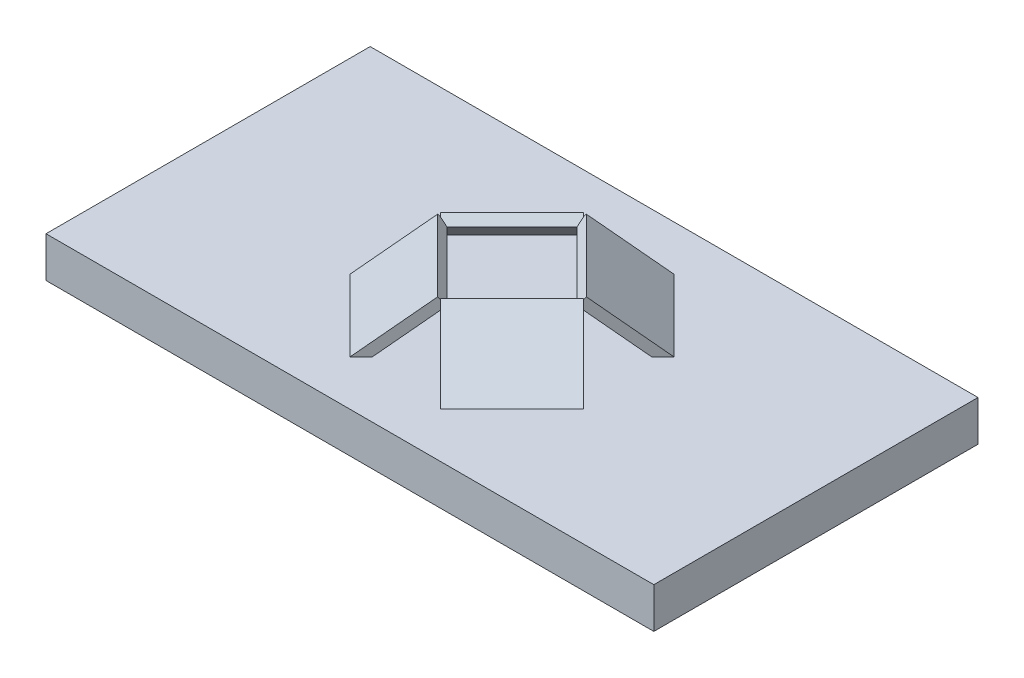
from build123d import *

# Parameters (mm, degrees)
SKETCH1_W           = 30
SKETCH1_H           = 16
BOSS_EXTRUDE1_DEPTH = 2
SKETCH4_W           = 5
SKETCH4_H           = 4
BOSS_EXTRUDE2_DEPTH = 0.5
CIRPATTERN1_COUNT   = 4


with BuildPart() as part:
    # Sketch1 → Boss-Extrude1 (new body)
    with BuildSketch(Plane(origin=(0, 0, 0), x_dir=(1, 0, 0), z_dir=(0, 1, 0))):
        Rectangle(SKETCH1_W, SKETCH1_H)
    extrude(amount=BOSS_EXTRUDE1_DEPTH)

    # Sketch4 → Boss-Extrude2 (add)
    with BuildSketch(Plane(origin=(-2.349067885, 3.959105139, 2.349067885), x_dir=(0.7071067811865479, 0, 0.7071067811865471), z_dir=(0.4545194776720462, -0.7660444431189748, -0.4545194776720467))):
        with Locations((0, 1.047826544)):
            Rectangle(SKETCH4_W, SKETCH4_H)
    boss_extrude2 = extrude(amount=BOSS_EXTRUDE2_DEPTH)

    # CirPattern1: Boss-Extrude2 ×4 about axis
    cirpattern1_axis = Axis((0, 0, 0), (0, 1, 0))
    for i in range(1, CIRPATTERN1_COUNT):
        add(boss_extrude2.rotate(cirpattern1_axis, i * 360 / CIRPATTERN1_COUNT))


solid = part.part
